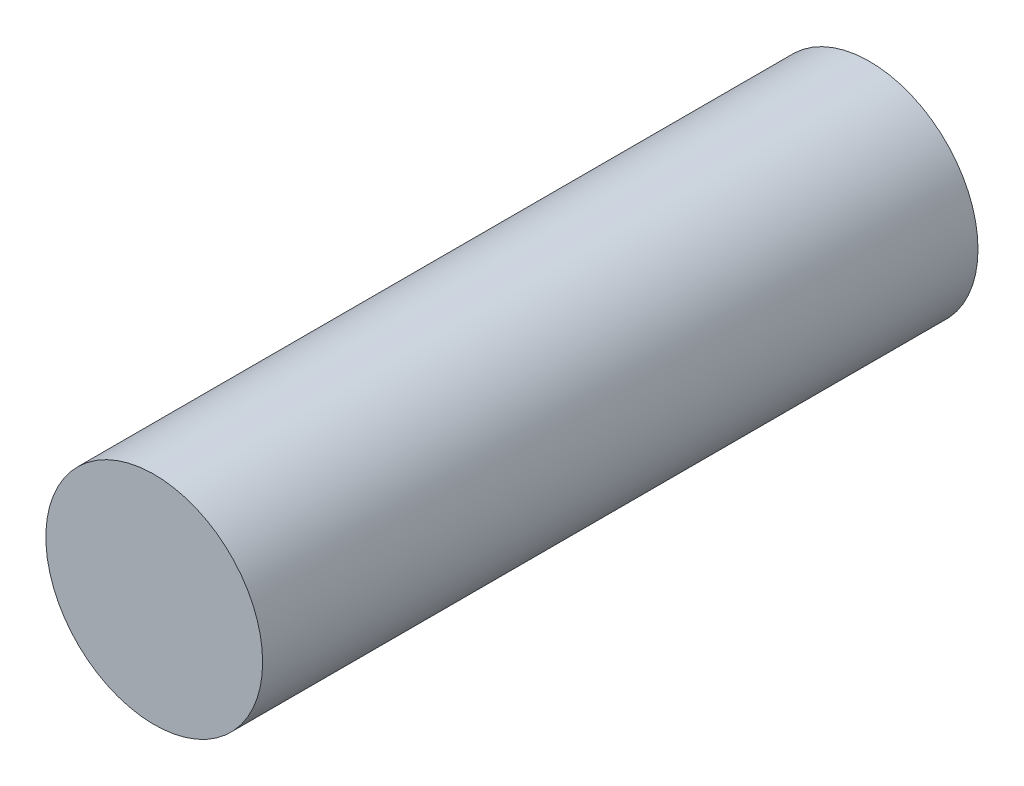
from build123d import *

# Parameters (mm, degrees)
SKETCH1_R           = 6.35
BOSS_EXTRUDE2_DEPTH = 41.91


with BuildPart() as part:
    # Sketch1 → Boss-Extrude2 (new body)
    with BuildSketch(Plane.XY):
        Circle(SKETCH1_R)
    extrude(amount=BOSS_EXTRUDE2_DEPTH)


solid = part.part
